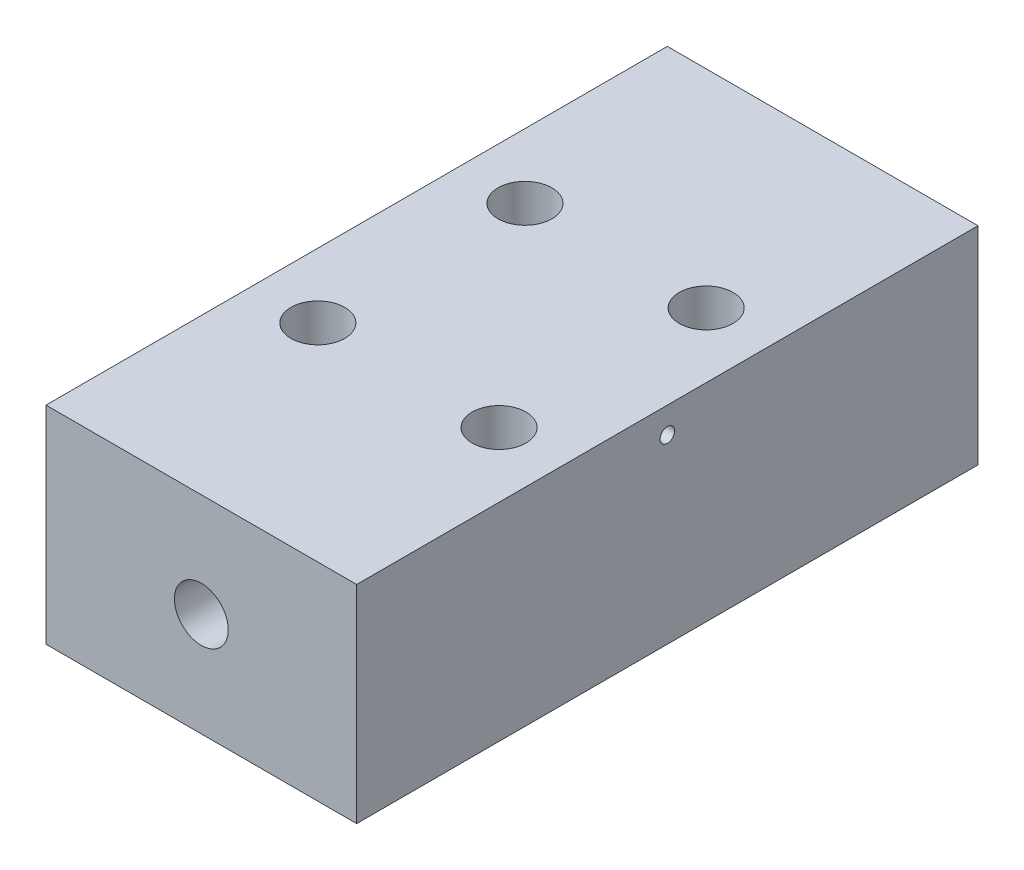
from build123d import *

# Parameters (mm, degrees)
SKETCH1_W           = 38.1
SKETCH1_H           = 25.4
BOSS_EXTRUDE1_DEPTH = 76.2
SKETCH2_R           = 3.302
CUT_EXTRUDE1_DEPTH  = 80.565271947
SKETCH3_R           = 3.302
CUT_EXTRUDE2_DEPTH  = 83.55
SKETCH5_R           = 0.889
CUT_EXTRUDE3_DEPTH  = 12.7
CUT_EXTRUDE4_START  = -12.7
SKETCH6_R           = 0.889
CUT_EXTRUDE4_DEPTH  = 12.7


with BuildPart() as part:
    # Sketch1 → Boss-Extrude1 (new body)
    with BuildSketch(Plane.XY):
        Rectangle(SKETCH1_W, SKETCH1_H)
    extrude(amount=BOSS_EXTRUDE1_DEPTH)

    # Sketch2 → Cut-Extrude1 (cut, through all)
    with BuildSketch(Plane.XY.offset(76.2)):
        Circle(SKETCH2_R)
    extrude(amount=-CUT_EXTRUDE1_DEPTH, mode=Mode.SUBTRACT)

    # Sketch3 → Cut-Extrude2 (cut, through all)
    with BuildSketch(Plane(origin=(0, 12.7, 0), x_dir=(1, 0, 0), z_dir=(0, 1, 0))):
        with Locations(Location((-11.1125, -25.4, 0), (0, 0, 180))):
            Circle(SKETCH3_R)
        with Locations(Location((11.1125, -25.4, 0), (0, 0, 180))):
            Circle(SKETCH3_R)
        with Locations(Location((-11.1125, -50.8, 0), (0, 0, 180))):
            Circle(SKETCH3_R)
        with Locations(Location((11.1125, -50.8, 0), (0, 0, 180))):
            Circle(SKETCH3_R)
    extrude(amount=-CUT_EXTRUDE2_DEPTH, mode=Mode.SUBTRACT)

    # Sketch5 → Cut-Extrude3 (cut)
    with BuildSketch(Plane(origin=(19.05, 0, 0), x_dir=(0, 0, -1), z_dir=(1, 0, 0))):
        with Locations((-38.1, 9.525)):
            Circle(SKETCH5_R)
    extrude(amount=-CUT_EXTRUDE3_DEPTH, mode=Mode.SUBTRACT)

    # Sketch6 → Cut-Extrude4 (cut)
    with BuildSketch(Plane.ZY.offset(19.05).offset(CUT_EXTRUDE4_START)):
        with Locations(Location((38.1, 9.525, 0), (0, 0, 180))):
            Circle(SKETCH6_R)
    extrude(amount=CUT_EXTRUDE4_DEPTH, mode=Mode.SUBTRACT)


solid = part.part
